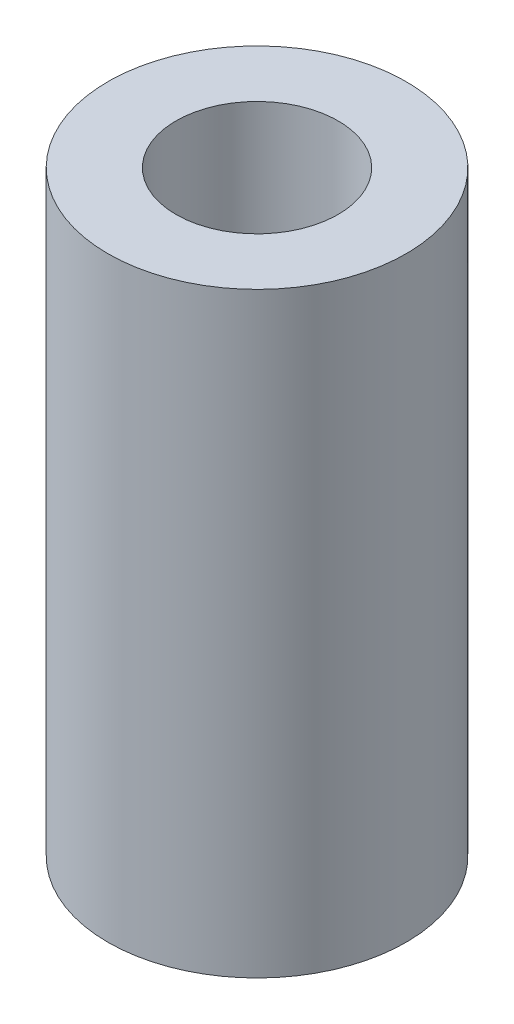
from build123d import *

# Parameters (mm, degrees)
SKETCH1_R           = 3.175
BOSS_EXTRUDE1_DEPTH = 12.7
CUT_EXTRUDE1_START  = -3.96875
SKETCH2_R           = 1.7272
CUT_EXTRUDE1_DEPTH  = 18.439134182


with BuildPart() as part:
    # Sketch1 → Boss-Extrude1 (new body)
    with BuildSketch(Plane(origin=(0, 0, 0), x_dir=(1, 0, 0), z_dir=(0, 1, 0))):
        with Locations(Location((0, 0, 0), (0, 0, 270))):
            Circle(SKETCH1_R)
    extrude(amount=BOSS_EXTRUDE1_DEPTH)

    # Sketch2 → Cut-Extrude1 (cut)
    with BuildSketch(Plane(origin=(0, 12.7, 0), x_dir=(1, 0, 0), z_dir=(0, 1, 0)).offset(CUT_EXTRUDE1_START)):
        with Locations(Location((0, 0, 0), (0, 0, 270))):
            Circle(SKETCH2_R)
    cut_extrude1 = extrude(amount=CUT_EXTRUDE1_DEPTH, mode=Mode.SUBTRACT)

    # Mirror1: Cut-Extrude1 across plane
    add(cut_extrude1.mirror(Plane.ZX.offset(6.35)), mode=Mode.SUBTRACT)


solid = part.part
